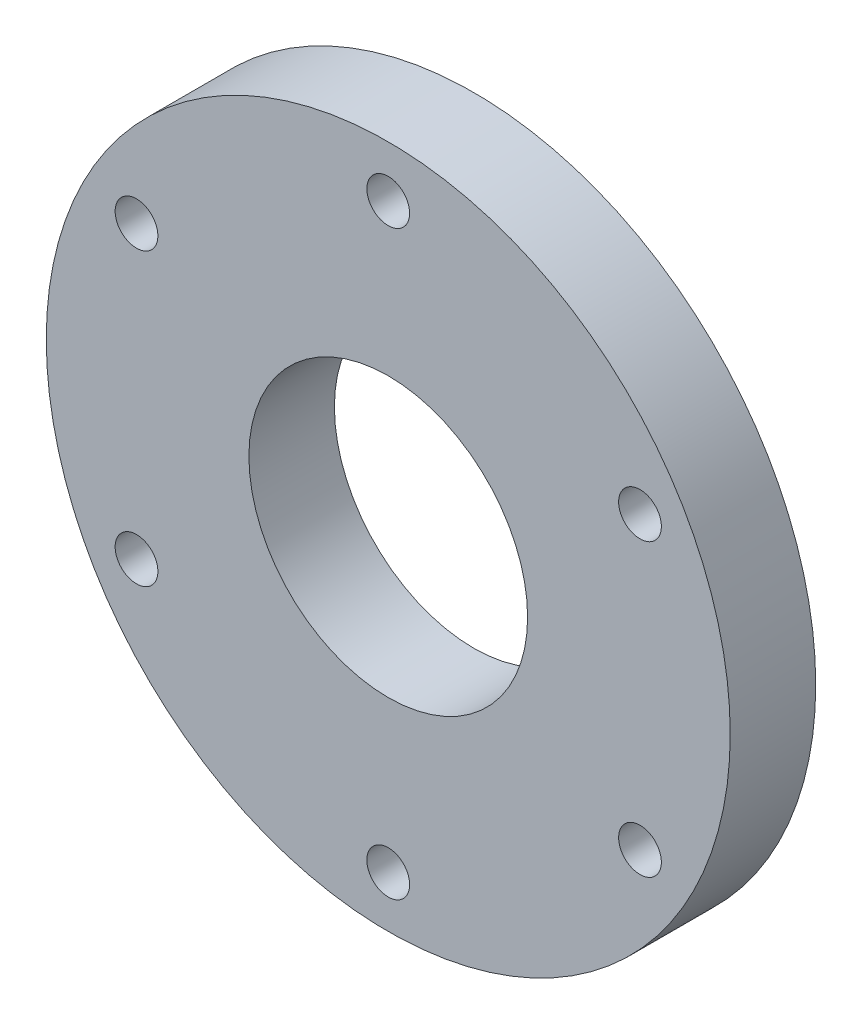
from build123d import *

# Parameters (mm, degrees)
SKETCH1_R           = 20
SKETCH1_R_2         = 1.25
SKETCH1_R_3         = 8.15
BOSS_EXTRUDE1_DEPTH = 5


with BuildPart() as part:
    # Sketch1 → Boss-Extrude1 (new body)
    with BuildSketch(Plane.XY):
        Circle(SKETCH1_R)
        with Locations((0, 17)):
            Circle(SKETCH1_R_2, mode=Mode.SUBTRACT)
        with Locations((14.722431864, 8.5)):
            Circle(SKETCH1_R_2, mode=Mode.SUBTRACT)
        with Locations((14.722431864, -8.5)):
            Circle(SKETCH1_R_2, mode=Mode.SUBTRACT)
        with Locations((0, -17)):
            Circle(SKETCH1_R_2, mode=Mode.SUBTRACT)
        with Locations((-14.722431864, -8.5)):
            Circle(SKETCH1_R_2, mode=Mode.SUBTRACT)
        with Locations((-14.722431864, 8.5)):
            Circle(SKETCH1_R_2, mode=Mode.SUBTRACT)
        Circle(SKETCH1_R_3, mode=Mode.SUBTRACT)
    extrude(amount=BOSS_EXTRUDE1_DEPTH)


solid = part.part
